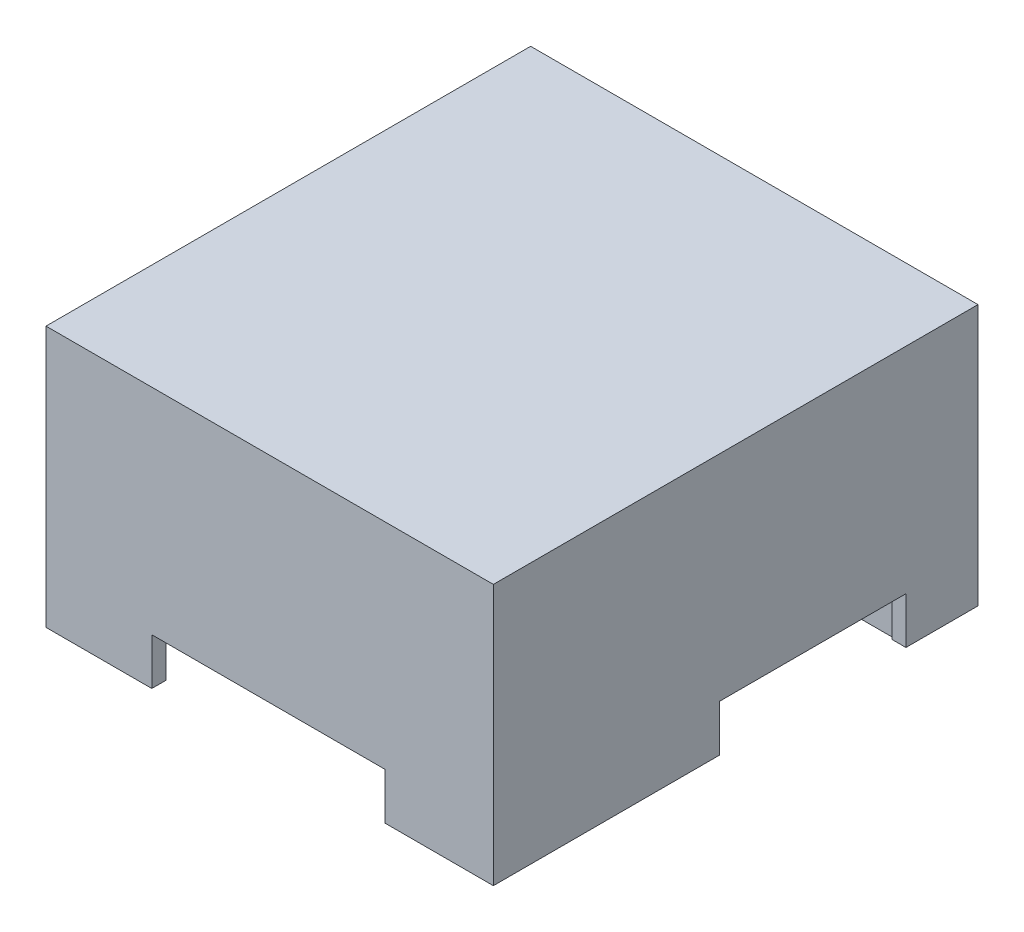
from build123d import *

# Parameters (mm, degrees)
SKETCH1_W           = 48
SKETCH1_H           = 52
SKETCH1_W_2         = 45
SKETCH1_H_2         = 49
BOSS_EXTRUDE1_DEPTH = 25
SKETCH2_W           = 6
SKETCH2_H           = 6
BOSS_EXTRUDE2_DEPTH = 15
SKETCH3_R           = 1
CUT_EXTRUDE1_DEPTH  = 10
SKETCH4_W           = 48
SKETCH4_H           = 52
BOSS_EXTRUDE3_DEPTH = 3
SKETCH5_W           = 25
SKETCH5_H           = 5
CUT_EXTRUDE2_DEPTH  = 3
SKETCH6_W           = 20
SKETCH6_H           = 5
CUT_EXTRUDE3_DEPTH  = 3
SKETCH7_W           = 20
SKETCH7_H           = 5
CUT_EXTRUDE4_DEPTH  = 3


with BuildPart() as part:
    # Sketch1 → Boss-Extrude1 (new body)
    with BuildSketch(Plane(origin=(0, 0, 0), x_dir=(1, 0, 0), z_dir=(0, 1, 0))):
        Rectangle(SKETCH1_W, SKETCH1_H)
        Rectangle(SKETCH1_W_2, SKETCH1_H_2, mode=Mode.SUBTRACT)
    extrude(amount=BOSS_EXTRUDE1_DEPTH)

    # Sketch2 → Boss-Extrude2 (add)
    with BuildSketch(Plane(origin=(0, 0, 0), x_dir=(1, 0, 0), z_dir=(0, 1, 0))):
        with Locations((-19.5, 21.5)):
            Rectangle(SKETCH2_W, SKETCH2_H)
        with Locations((19.5, 21.5)):
            Rectangle(SKETCH2_W, SKETCH2_H)
        with Locations((19.5, -21.5)):
            Rectangle(SKETCH2_W, SKETCH2_H)
        with Locations((-19.5, -21.5)):
            Rectangle(SKETCH2_W, SKETCH2_H)
    extrude(amount=BOSS_EXTRUDE2_DEPTH)

    # Sketch3 → Cut-Extrude1 (cut)
    with BuildSketch(Plane(origin=(0, 0, 0), x_dir=(1, 0, 0), z_dir=(0, 1, 0))):
        with Locations(Location((-18.75, 20.623770818, 0), (0, 0, 270))):
            Circle(SKETCH3_R)
        with Locations(Location((18.75, 20.623770818, 0), (0, 0, 90))):
            Circle(SKETCH3_R)
        with Locations(Location((18.75, -20.876229182, 0), (0, 0, 270))):
            Circle(SKETCH3_R)
        with Locations(Location((-18.75, -20.876229182, 0), (0, 0, 90))):
            Circle(SKETCH3_R)
    extrude(amount=CUT_EXTRUDE1_DEPTH, mode=Mode.SUBTRACT)

    # Sketch4 → Boss-Extrude3 (add)
    with BuildSketch(Plane(origin=(0, 25, 0), x_dir=(1, 0, 0), z_dir=(0, 1, 0))):
        Rectangle(SKETCH4_W, SKETCH4_H)
    extrude(amount=BOSS_EXTRUDE3_DEPTH)

    # Sketch5 → Cut-Extrude2 (cut)
    with BuildSketch(Plane.XY.offset(26)):
        with Locations((-0.148610248, 2.5)):
            Rectangle(SKETCH5_W, SKETCH5_H)
    extrude(amount=-CUT_EXTRUDE2_DEPTH, mode=Mode.SUBTRACT)

    # Sketch6 → Cut-Extrude3 (cut)
    with BuildSketch(Plane(origin=(24, 0, 0), x_dir=(0, 0, -1), z_dir=(1, 0, 0))):
        with Locations((8.266776226, 2.5)):
            Rectangle(SKETCH6_W, SKETCH6_H)
    extrude(amount=-CUT_EXTRUDE3_DEPTH, mode=Mode.SUBTRACT)

    # Sketch7 → Cut-Extrude4 (cut)
    with BuildSketch(Plane.ZY.offset(24)):
        with Locations((8.18424176, 2.5)):
            Rectangle(SKETCH7_W, SKETCH7_H)
    extrude(amount=-CUT_EXTRUDE4_DEPTH, mode=Mode.SUBTRACT)


solid = part.part
